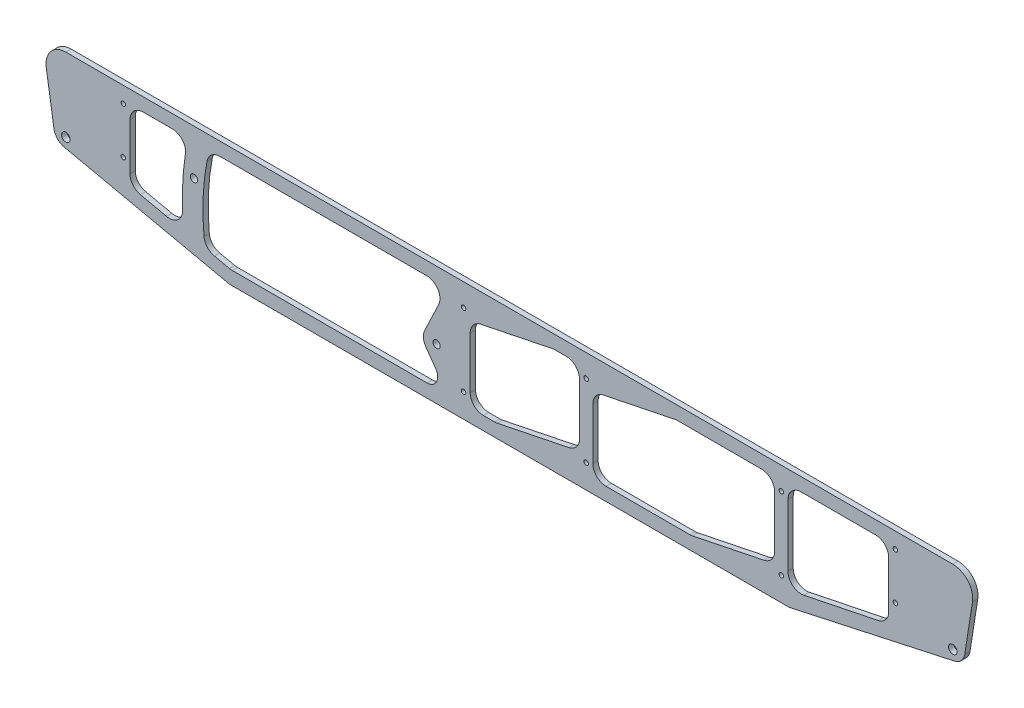
from build123d import *

# Parameters (mm, degrees)
SKETCH_1_R          = 3.25
EXTRUDE_1_DEPTH     = 4
HOLE_WIZARD_M52_D   = 5.5
CUT_EXTRUDE_3_DEPTH = 353.903669576
FILLET_2_R          = 10
FILLET_3_R          = 10
HOLE_WIZARD_M31_D   = 3.4
FILLET_4_R          = 8


with BuildPart() as part:
    # Эскиз1 → Бобышка-Вытянуть1 (new body)
    with BuildSketch(Plane.XY):
        with BuildLine():
            Line((-349.818316726, 27.672449915), (-342.910885265, -16.303620822))
            Line((-342.910885265, -16.303620822), (-211.481081006, -45))
            Line((-211.481081006, -45), (211.481081006, -45))
            Line((211.481081006, -45), (342.910885265, -16.303620822))
            Line((342.910885265, -16.303620822), (349.818316726, 27.672449915))
            ThreePointArc((349.818316726, 27.672449915), (346.399852001, 39.749019149), (335, 45))
            Line((335, 45), (-335, 45))
            ThreePointArc((-335, 45), (-346.399852001, 39.749019149), (-349.818316726, 27.672449915))
        make_face()
        with Locations((-335, -10.635315981)):
            Circle(SKETCH_1_R, mode=Mode.SUBTRACT)
        with Locations(Location((335, -10.635315981, 0), (0, 0, 180))):
            Circle(SKETCH_1_R, mode=Mode.SUBTRACT)
    extrude(amount=EXTRUDE_1_DEPTH)

    # Отверстие с зазором M52 (through all)
    with Locations(Plane(origin=(0, 0, 0), x_dir=(-1, 0, 0), z_dir=(0, 0, -1))):
        with Locations((55, -6), (238.23, 10.84)):
            Hole(HOLE_WIZARD_M52_D / 2)

    # Эскиз10 → Вырез-Вытянуть3 (cut, through all)
    with BuildSketch(Plane.XY.offset(4)):
        with BuildLine():
            Line((-286.571319769, 35), (-242.571319769, 35))
            ThreePointArc((-242.571319769, 35), (-246.739453064, 3.999106889), (-245.818518827, -27.267178292))
            Line((-245.818518827, -27.267178292), (-286.571319769, -18.369213063))
            Line((-286.571319769, -18.369213063), (-286.571319769, 35))
        make_face()
        with BuildLine():
            Line((-226.671925486, 35), (-46.587816989, 35))
            Line((-46.587816989, 35), (-64.032014151, -1.707830342))
            ThreePointArc((-64.032014151, -1.707830342), (-64.961194769, -6.880112935), (-63.13950341, -11.809344562))
            Line((-63.13950341, -11.809344562), (-46.587816989, -35))
            Line((-46.587816989, -35), (-210.402090952, -35))
            Line((-210.402090952, -35), (-229.752534006, -30.775024894))
            ThreePointArc((-229.752534006, -30.775024894), (-231.306735573, 2.257420391), (-226.671925486, 35))
        make_face()
        Polygon((286.571319769, 35), (286.571319769, -18.369213063), (210.402090952, -34), (210.402090952, 35), align=None)
        Polygon((200.402090952, 35), (126.145146633, 35), (63.036502818, 22.049392771), (63.036502818, -35), (137.293447136, -35), (200.402090952, -22.049392771), align=None)
        Polygon((-29.597909048, 22.049392771), (-29.597909048, -35), (-10.072140997, -35), (53.036502818, -22.049392771), (53.036502818, 35), (33.510734767, 35), align=None)
    extrude(amount=-CUT_EXTRUDE_3_DEPTH, mode=Mode.SUBTRACT)

    # Скругление2
    fillet_2_edges = [part.edges().sort_by_distance(p)[0] for p in [
        (342.910885265, -16.303620822, 2),
        (211.481081006, -45, 2),
        (-211.481081006, -45, 2),
        (-342.910885265, -16.303620822, 2),
        (-286.571319769, -18.369213063, 2),
        (-286.571319769, 35, 2),
        (-242.571319769, 35, 2),
        (-245.818518827, -27.267178292, 2),
        (210.402090952, 35, 2),
        (286.571319769, 35, 2),
        (286.571319769, -18.369213063, 2),
        (210.402090952, -34, 2),
        (-210.402090952, -35, 2),
        (-229.752534006, -30.775024894, 2),
        (-226.671925486, 35, 2),
        (-46.587816989, 35, 2),
    ]]
    fillet(fillet_2_edges, radius=FILLET_2_R)

    # Скругление3
    fillet_3_edges = [part.edges().sort_by_distance(p)[0] for p in [
        (33.510734767, 35, 2),
        (53.036502818, 35, 2),
        (53.036502818, -22.049392771, 2),
        (-10.072140997, -35, 2),
        (-29.597909048, -35, 2),
        (-29.597909048, 22.049392771, 2),
        (63.036502818, 22.049392771, 2),
        (126.145146633, 35, 2),
        (200.402090952, 35, 2),
        (200.402090952, -22.049392771, 2),
        (137.293447136, -35, 2),
        (63.036502818, -35, 2),
    ]]
    fillet(fillet_3_edges, radius=FILLET_3_R)

    # Отверстие с зазором M31 (through all)
    with Locations(Plane.XY.offset(4)):
        with Locations((-34.597909048, 28), (-34.597909048, -27), (205.402090952, -27), (205.402090952, 28), (291.571319769, 33), (291.6163356, -2), (-291.6163356, -2), (-291.571319769, 33), (58.036502818, 28), (58.036502818, -27)):
            Hole(HOLE_WIZARD_M31_D / 2)

    # Скругление4
    fillet_4_edges = [part.edges().sort_by_distance(p)[0] for p in [
        (-46.587816989, -35, 2),
    ]]
    fillet(fillet_4_edges, radius=FILLET_4_R)


solid = part.part
